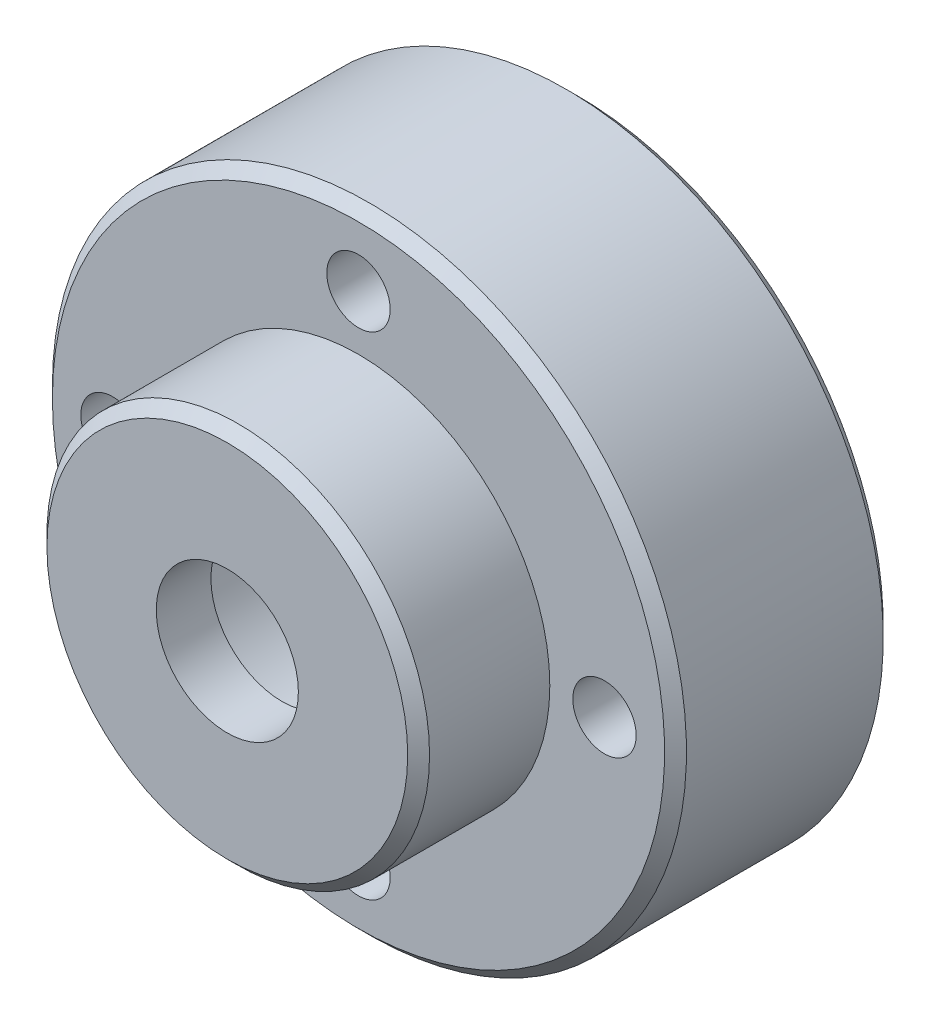
from build123d import *

# Parameters (mm, degrees)
SKETCH_1_R                   = 17.5
EXTRUDE_1_DEPTH              = 12
SKETCH_2_R                   = 29
EXTRUDE_2_DEPTH              = 20
SKETCH_3_R                   = 6.5
CUT_EXTRUDE_1_DEPTH          = 53.019227215
SKETCH_4_R                   = 11.05
CUT_EXTRUDE_2_DEPTH          = 27
CHAMFER_1_SIZE               = 1
HOLE_WIZARD_M5_1_D           = 5.8
HOLE_WIZARD_M5_1_CBORE_D     = 10
HOLE_WIZARD_M5_1_CBORE_DEPTH = 5


with BuildPart() as part:
    # 草图1 → 凸台-拉伸1 (new body)
    with BuildSketch(Plane.XY):
        Circle(SKETCH_1_R)
    extrude(amount=-EXTRUDE_1_DEPTH)

    # 草图2 → 凸台-拉伸2 (add)
    with BuildSketch(Plane(origin=(0, 0, -12), x_dir=(-1, 0, 0), z_dir=(0, 0, -1))):
        Circle(SKETCH_2_R)
    extrude(amount=EXTRUDE_2_DEPTH)

    # 草图3 → 切除-拉伸1 (cut, through all)
    with BuildSketch(Plane.XY):
        Circle(SKETCH_3_R)
    extrude(amount=-CUT_EXTRUDE_1_DEPTH, mode=Mode.SUBTRACT)

    # 草图4 → 切除-拉伸2 (cut)
    with BuildSketch(Plane(origin=(0, 0, -32), x_dir=(-1, 0, 0), z_dir=(0, 0, -1))):
        Circle(SKETCH_4_R)
    extrude(amount=-CUT_EXTRUDE_2_DEPTH, mode=Mode.SUBTRACT)

    # 倒角1
    chamfer_1_edges = [part.edges().sort_by_distance(p)[0] for p in [
        (-17.5, 0, 0),
        (29, 0, -12),
        (29, 0, -32),
    ]]
    chamfer(chamfer_1_edges, length=CHAMFER_1_SIZE)

    # M5 六角凹头螺钉的柱形沉头孔1 (through all)
    with Locations(Plane(origin=(0, 0, -32), x_dir=(-1, 0, 0), z_dir=(0, 0, -1))):
        with Locations((0, 22.5), (-22.5, 0), (0, -22.5), (22.5, 0)):
            CounterBoreHole(HOLE_WIZARD_M5_1_D / 2, HOLE_WIZARD_M5_1_CBORE_D / 2, HOLE_WIZARD_M5_1_CBORE_DEPTH)


solid = part.part
